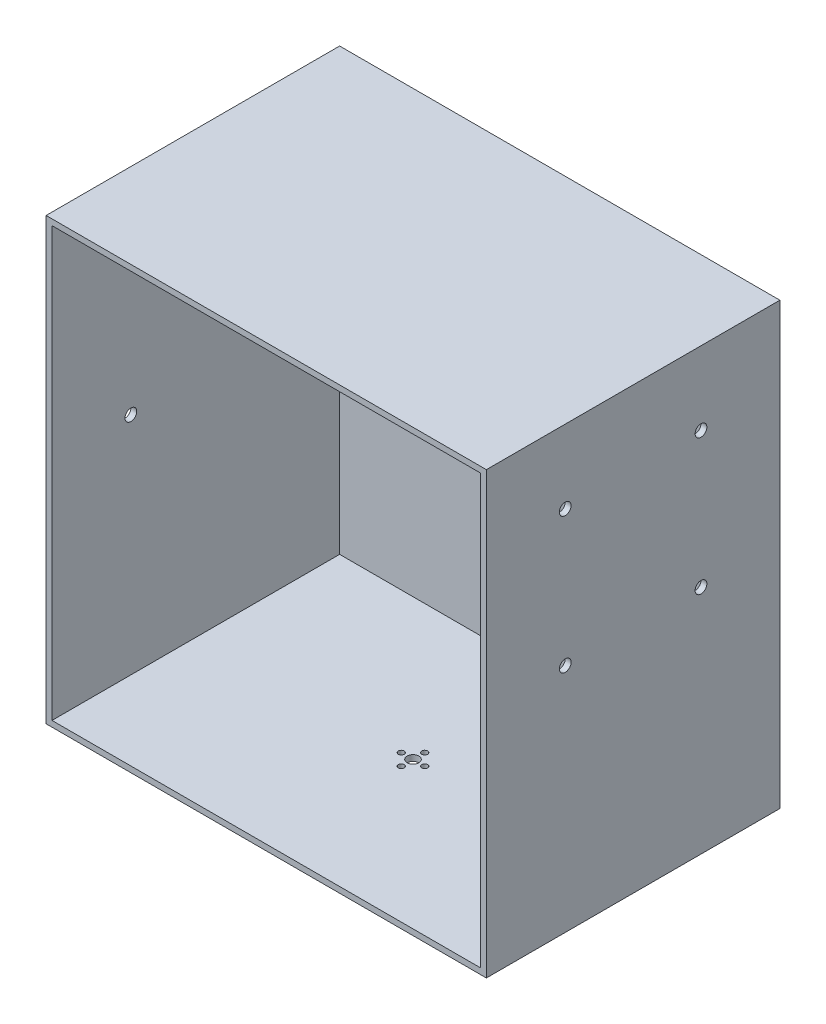
from build123d import *

# Parameters (mm, degrees)
IZIM1_W                     = 300
IZIM1_H                     = 300
Y_KSEKLIK_EKSTR_ZYON1_DEPTH = 200
BO_ALTMA1_T                 = -4
KES_EKSTR_ZYON1_REACH       = 471.042
IZIM2_R                     = 4
KES_EKSTR_ZYON2_REACH       = 471.042
IZIM3_R                     = 4
IZIM3_R_2                   = 2


with BuildPart() as part:
    # Çizim1 → Yükseklik-Ekstrüzyon1 (new body)
    with BuildSketch(Plane.XY):
        with Locations((-150, 150)):
            Rectangle(IZIM1_W, IZIM1_H)
    extrude(amount=Y_KSEKLIK_EKSTR_ZYON1_DEPTH)

    # İç Boşaltma1
    bo_altma1_openings = [part.faces().sort_by_distance(p)[0] for p in [
        (-150, 150, 200),
    ]]
    offset(amount=BO_ALTMA1_T, openings=bo_altma1_openings, kind=Kind.INTERSECTION)

    # Çizim2 → Kes-Ekstrüzyon1 (cut, up to next)
    with BuildSketch(Plane.ZY.offset(300), mode=Mode.PRIVATE) as kes_ekstr_zyon1_sk1:
        with Locations((146.25, 250)):
            Circle(IZIM2_R)
    kes_ekstr_zyon1_tool1 = extrude(kes_ekstr_zyon1_sk1.sketch, amount=-KES_EKSTR_ZYON1_REACH, mode=Mode.PRIVATE) & part.part
    # Çizim2 → Kes-Ekstrüzyon1 (cut, up to next)
    with BuildSketch(Plane.ZY.offset(300), mode=Mode.PRIVATE) as kes_ekstr_zyon1_sk2:
        with Locations((53.75, 250)):
            Circle(IZIM2_R)
    kes_ekstr_zyon1_tool2 = extrude(kes_ekstr_zyon1_sk2.sketch, amount=-KES_EKSTR_ZYON1_REACH, mode=Mode.PRIVATE) & part.part
    # Çizim2 → Kes-Ekstrüzyon1 (cut, up to next)
    with BuildSketch(Plane.ZY.offset(300), mode=Mode.PRIVATE) as kes_ekstr_zyon1_sk3:
        with Locations((146.25, 157.5)):
            Circle(IZIM2_R)
    kes_ekstr_zyon1_tool3 = extrude(kes_ekstr_zyon1_sk3.sketch, amount=-KES_EKSTR_ZYON1_REACH, mode=Mode.PRIVATE) & part.part
    # Çizim2 → Kes-Ekstrüzyon1 (cut, up to next)
    with BuildSketch(Plane.ZY.offset(300), mode=Mode.PRIVATE) as kes_ekstr_zyon1_sk4:
        with Locations((53.75, 157.5)):
            Circle(IZIM2_R)
    kes_ekstr_zyon1_tool4 = extrude(kes_ekstr_zyon1_sk4.sketch, amount=-KES_EKSTR_ZYON1_REACH, mode=Mode.PRIVATE) & part.part
    kes_ekstr_zyon1_1 = kes_ekstr_zyon1_tool1.solids().sort_by_distance((-300, 250, 146.25))[0]
    add(kes_ekstr_zyon1_1, mode=Mode.SUBTRACT)
    kes_ekstr_zyon1_2 = kes_ekstr_zyon1_tool2.solids().sort_by_distance((-300, 250, 53.75))[0]
    add(kes_ekstr_zyon1_2, mode=Mode.SUBTRACT)
    kes_ekstr_zyon1_3 = kes_ekstr_zyon1_tool3.solids().sort_by_distance((-300, 157.5, 146.25))[0]
    add(kes_ekstr_zyon1_3, mode=Mode.SUBTRACT)
    kes_ekstr_zyon1_4 = kes_ekstr_zyon1_tool4.solids().sort_by_distance((-300, 157.5, 53.75))[0]
    add(kes_ekstr_zyon1_4, mode=Mode.SUBTRACT)
    kes_ekstr_zyon1 = kes_ekstr_zyon1_1 + kes_ekstr_zyon1_2 + kes_ekstr_zyon1_3 + kes_ekstr_zyon1_4  # Kes-Ekstrüzyon1 as one shape, for the pattern or mirror that repeats it

    # Aynalama1: Kes-Ekstrüzyon1 across plane
    add(kes_ekstr_zyon1.mirror(Plane(origin=(-150, 0, 0), x_dir=(0, 0, 1), z_dir=(1, 0, 0))), mode=Mode.SUBTRACT)

    # Çizim3 → Kes-Ekstrüzyon2 (cut, up to next)
    with BuildSketch(Plane.XZ, mode=Mode.PRIVATE) as kes_ekstr_zyon2_sk1:
        with Locations(Location((-150, 100, 0), (0, 0, 270))):
            Circle(IZIM3_R)
    kes_ekstr_zyon2_tool1 = extrude(kes_ekstr_zyon2_sk1.sketch, amount=-KES_EKSTR_ZYON2_REACH, mode=Mode.PRIVATE) & part.part
    # Çizim3 → Kes-Ekstrüzyon2 (cut, up to next)
    with BuildSketch(Plane.XZ, mode=Mode.PRIVATE) as kes_ekstr_zyon2_sk2:
        with Locations(Location((-150, 108, 0), (0, 0, 270))):
            Circle(IZIM3_R_2)
    kes_ekstr_zyon2_tool2 = extrude(kes_ekstr_zyon2_sk2.sketch, amount=-KES_EKSTR_ZYON2_REACH, mode=Mode.PRIVATE) & part.part
    # Çizim3 → Kes-Ekstrüzyon2 (cut, up to next)
    with BuildSketch(Plane.XZ, mode=Mode.PRIVATE) as kes_ekstr_zyon2_sk3:
        with Locations(Location((-158, 100, 0), (0, 0, 270))):
            Circle(IZIM3_R_2)
    kes_ekstr_zyon2_tool3 = extrude(kes_ekstr_zyon2_sk3.sketch, amount=-KES_EKSTR_ZYON2_REACH, mode=Mode.PRIVATE) & part.part
    # Çizim3 → Kes-Ekstrüzyon2 (cut, up to next)
    with BuildSketch(Plane.XZ, mode=Mode.PRIVATE) as kes_ekstr_zyon2_sk4:
        with Locations(Location((-150, 92, 0), (0, 0, 270))):
            Circle(IZIM3_R_2)
    kes_ekstr_zyon2_tool4 = extrude(kes_ekstr_zyon2_sk4.sketch, amount=-KES_EKSTR_ZYON2_REACH, mode=Mode.PRIVATE) & part.part
    # Çizim3 → Kes-Ekstrüzyon2 (cut, up to next)
    with BuildSketch(Plane.XZ, mode=Mode.PRIVATE) as kes_ekstr_zyon2_sk5:
        with Locations(Location((-142, 100, 0), (0, 0, 270))):
            Circle(IZIM3_R_2)
    kes_ekstr_zyon2_tool5 = extrude(kes_ekstr_zyon2_sk5.sketch, amount=-KES_EKSTR_ZYON2_REACH, mode=Mode.PRIVATE) & part.part
    add(kes_ekstr_zyon2_tool1.solids().sort_by_distance((-150, 0, 100))[0], mode=Mode.SUBTRACT)
    add(kes_ekstr_zyon2_tool2.solids().sort_by_distance((-150, 0, 108))[0], mode=Mode.SUBTRACT)
    add(kes_ekstr_zyon2_tool3.solids().sort_by_distance((-158, 0, 100))[0], mode=Mode.SUBTRACT)
    add(kes_ekstr_zyon2_tool4.solids().sort_by_distance((-150, 0, 92))[0], mode=Mode.SUBTRACT)
    add(kes_ekstr_zyon2_tool5.solids().sort_by_distance((-142, 0, 100))[0], mode=Mode.SUBTRACT)


solid = part.part
